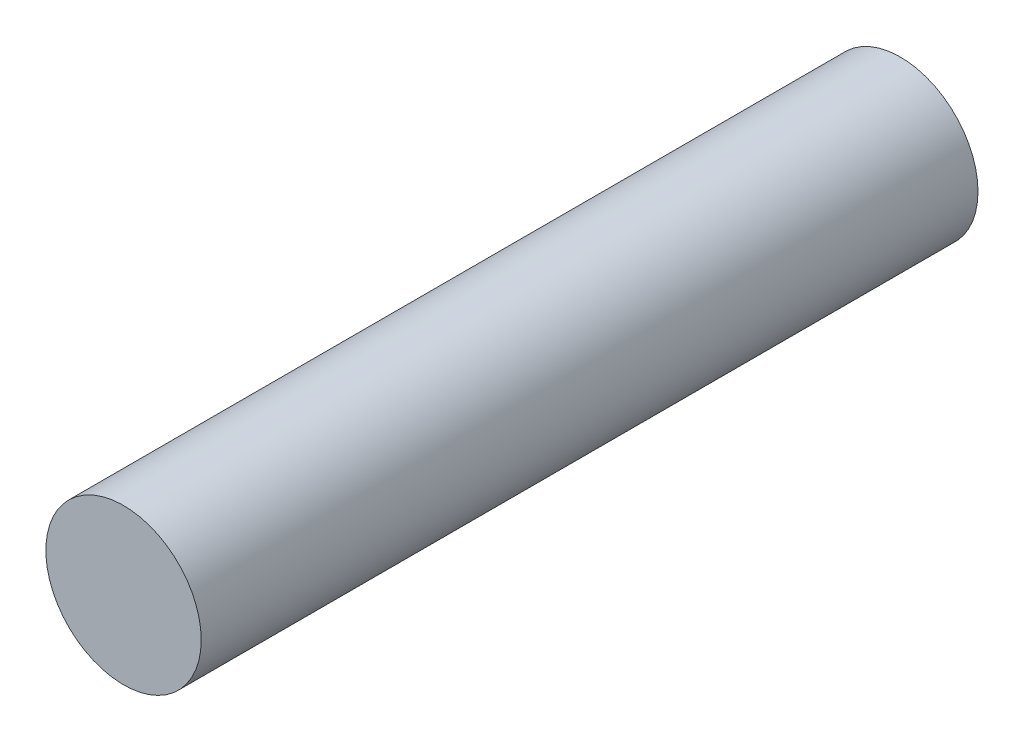
from build123d import *

# Parameters (mm, degrees)
SKETCH2_R           = 5
BOSS_EXTRUDE1_DEPTH = 50


with BuildPart() as part:
    # Sketch2 → Boss-Extrude1 (new body)
    with BuildSketch(Plane.XY):
        Circle(SKETCH2_R)
    extrude(amount=-BOSS_EXTRUDE1_DEPTH)


solid = part.part
